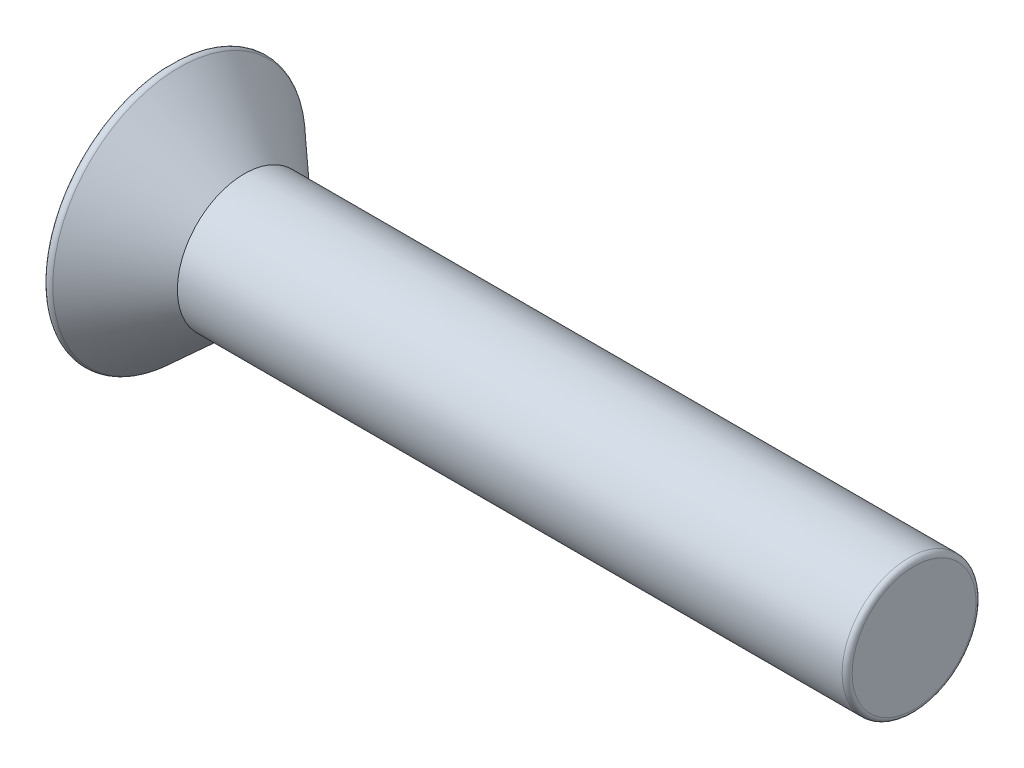
from build123d import *

# Parameters (mm, degrees)
KES_EKSTR_ZYON1_DEPTH = 5
RADYUS2_R             = 0.3


with BuildPart() as part:
    # Çizim1 → Döndür1 (revolve)
    with BuildSketch(Plane.XY, mode=Mode.PRIVATE) as d_nd_r1_sk:
        Polygon((0, 0), (0, 4), (-40, 4), (-44.4, 8), (-44.4, 0), align=None)
    revolve(d_nd_r1_sk.sketch.rotate(Axis((-44.4, 0, 0), (1, 0, 0)), 90), axis=Axis((-44.4, 0, 0), (1, 0, 0)))

    # Çizim2 → Kes-Ekstrüzyon1 (cut)
    with BuildSketch(Plane.ZY.offset(44.4)):
        Polygon((2.886751346, 0), (1.443375673, 2.5), (-1.443375673, 2.5), (-2.886751346, 0), (-1.443375673, -2.5), (1.443375673, -2.5), align=None)
    extrude(amount=-KES_EKSTR_ZYON1_DEPTH, mode=Mode.SUBTRACT)

    # Radyus2
    radyus2_edges = [part.edges().sort_by_distance(p)[0] for p in [
        (-44.4, 0, -8),
        (0, 0, -4),
    ]]
    fillet(radyus2_edges, radius=RADYUS2_R)


solid = part.part
